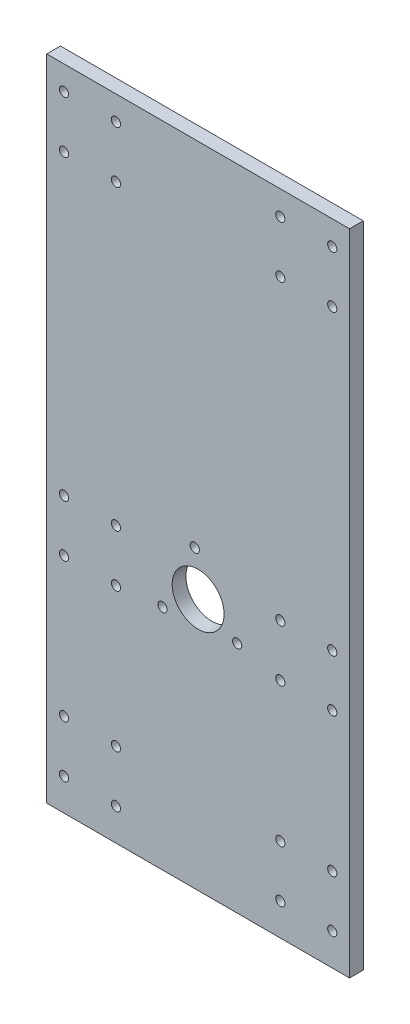
from build123d import *

# Parameters (mm, degrees)
SKETCH1_W           = 140
SKETCH1_H           = 300
SKETCH1_R           = 2.125
BOSS_EXTRUDE1_DEPTH = 6.35
SKETCH2_R           = 12
SKETCH2_R_2         = 2.125
CUT_EXTRUDE1_DEPTH  = 166.651207361


with BuildPart() as part:
    # Sketch1 → Boss-Extrude1 (new body)
    with BuildSketch(Plane.XY):
        Rectangle(SKETCH1_W, SKETCH1_H)
        with Locations((-62, 138.825)):
            Circle(SKETCH1_R, mode=Mode.SUBTRACT)
        with Locations(Location((-38, 138.825, 0), (0, 0, 180))):
            Circle(SKETCH1_R, mode=Mode.SUBTRACT)
        with Locations((-38, 114.825)):
            Circle(SKETCH1_R, mode=Mode.SUBTRACT)
        with Locations(Location((-62, 114.825, 0), (0, 0, 180))):
            Circle(SKETCH1_R, mode=Mode.SUBTRACT)
        with Locations(Location((38, 114.825, 0), (0, 0, 180))):
            Circle(SKETCH1_R, mode=Mode.SUBTRACT)
        with Locations((62, 114.825)):
            Circle(SKETCH1_R, mode=Mode.SUBTRACT)
        with Locations((38, 138.825)):
            Circle(SKETCH1_R, mode=Mode.SUBTRACT)
        with Locations(Location((62, 138.825, 0), (0, 0, 180))):
            Circle(SKETCH1_R, mode=Mode.SUBTRACT)
        with Locations((62, -46.825)):
            Circle(SKETCH1_R, mode=Mode.SUBTRACT)
        with Locations(Location((38, -46.825, 0), (0, 0, 180))):
            Circle(SKETCH1_R, mode=Mode.SUBTRACT)
        with Locations(Location((62, -22.825, 0), (0, 0, 180))):
            Circle(SKETCH1_R, mode=Mode.SUBTRACT)
        with Locations((38, -22.825)):
            Circle(SKETCH1_R, mode=Mode.SUBTRACT)
        with Locations((-62, -22.825)):
            Circle(SKETCH1_R, mode=Mode.SUBTRACT)
        with Locations(Location((-38, -22.825, 0), (0, 0, 180))):
            Circle(SKETCH1_R, mode=Mode.SUBTRACT)
        with Locations((-38, -46.825)):
            Circle(SKETCH1_R, mode=Mode.SUBTRACT)
        with Locations(Location((-62, -46.825, 0), (0, 0, 180))):
            Circle(SKETCH1_R, mode=Mode.SUBTRACT)
        with Locations((-62, -111.175)):
            Circle(SKETCH1_R, mode=Mode.SUBTRACT)
        with Locations(Location((-38, -111.175, 0), (0, 0, 180))):
            Circle(SKETCH1_R, mode=Mode.SUBTRACT)
        with Locations((-38, -135.175)):
            Circle(SKETCH1_R, mode=Mode.SUBTRACT)
        with Locations(Location((-62, -135.175, 0), (0, 0, 180))):
            Circle(SKETCH1_R, mode=Mode.SUBTRACT)
        with Locations(Location((38, -135.175, 0), (0, 0, 180))):
            Circle(SKETCH1_R, mode=Mode.SUBTRACT)
        with Locations((62, -135.175)):
            Circle(SKETCH1_R, mode=Mode.SUBTRACT)
        with Locations((38, -111.175)):
            Circle(SKETCH1_R, mode=Mode.SUBTRACT)
        with Locations(Location((62, -111.175, 0), (0, 0, 180))):
            Circle(SKETCH1_R, mode=Mode.SUBTRACT)
    extrude(amount=BOSS_EXTRUDE1_DEPTH)

    # Sketch2 → Cut-Extrude1 (cut, through all)
    with BuildSketch(Plane.XY.offset(6.35)):
        with Locations((0, -33.35)):
            Circle(SKETCH2_R)
        with Locations((-1.565325907, -13.411350226)):
            Circle(SKETCH2_R_2)
        with Locations((18.050040175, -41.963712886)):
            Circle(SKETCH2_R_2)
        with Locations((-16.484714268, -44.674936888)):
            Circle(SKETCH2_R_2)
    extrude(amount=-CUT_EXTRUDE1_DEPTH, mode=Mode.SUBTRACT)


solid = part.part
